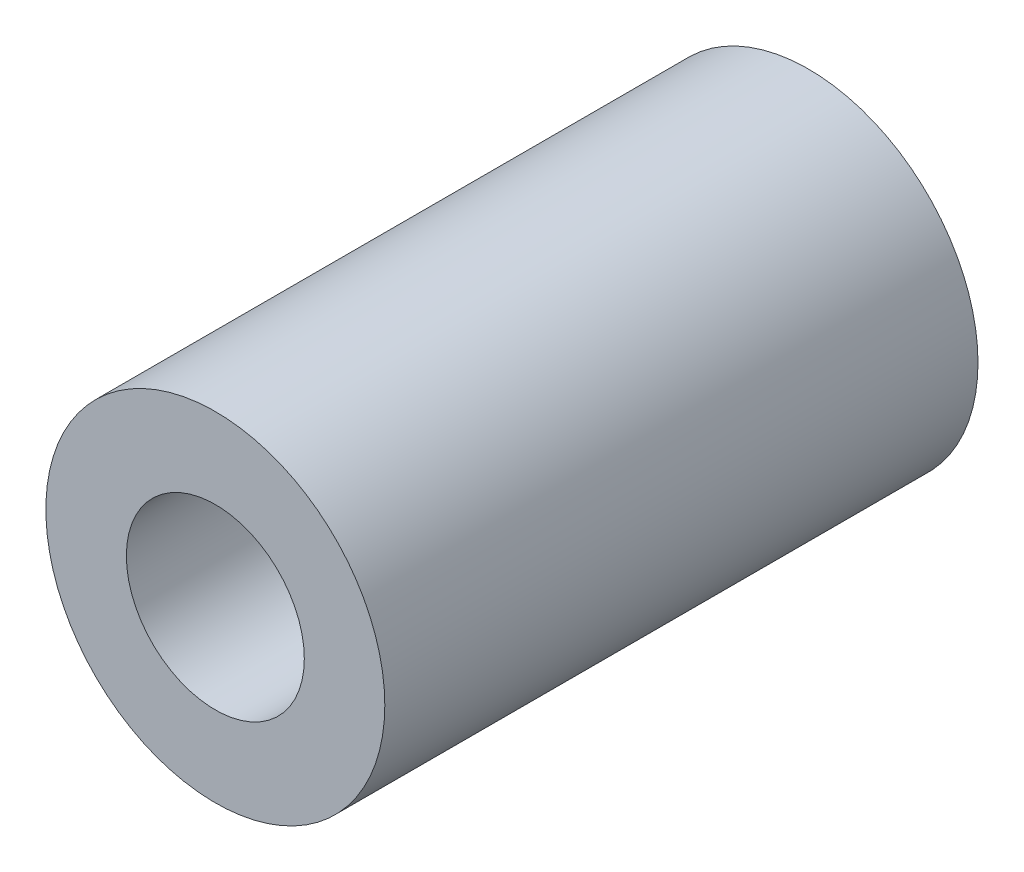
from build123d import *

# Parameters (mm, degrees)
SKETCH1_R      = 4
SKETCH1_R_2    = 2.1
EXTRUDE1_DEPTH = 7


with BuildPart() as part:
    # Sketch1 → Extrude1 (new, symmetric)
    with BuildSketch(Plane.XY):
        Circle(SKETCH1_R)
        Circle(SKETCH1_R_2, mode=Mode.SUBTRACT)
    extrude(amount=EXTRUDE1_DEPTH, both=True)


solid = part.part
